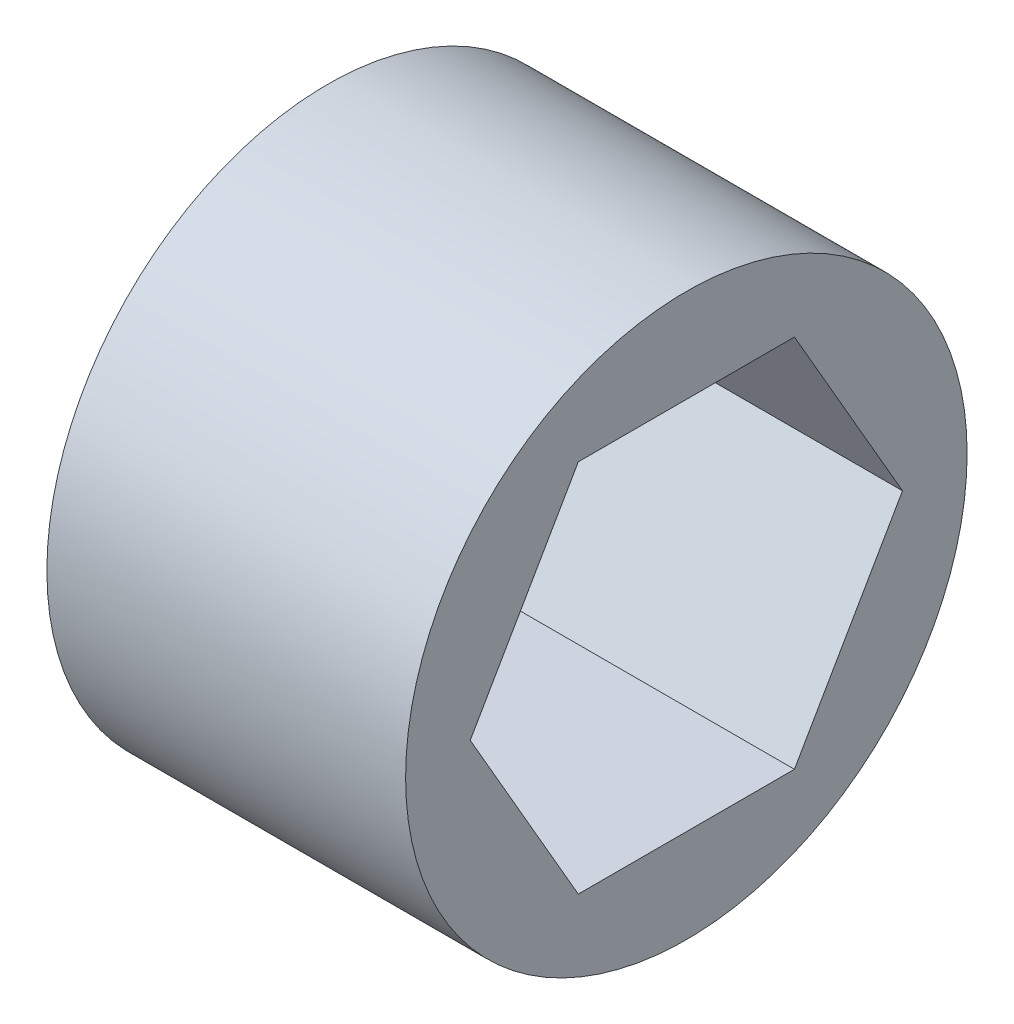
from build123d import *

# Parameters (mm, degrees)
SKETCH1_R           = 9.525
BOSS_EXTRUDE1_DEPTH = 6.085


with BuildPart() as part:
    # Sketch1 → Boss-Extrude1 (new, symmetric)
    with BuildSketch(Plane(origin=(0, 0, 0), x_dir=(0, 0, -1), z_dir=(1, 0, 0))):
        Circle(SKETCH1_R)
        Polygon((7.332348419, 0), (3.666174209, 6.35), (-3.666174209, 6.35), (-7.332348419, 0), (-3.666174209, -6.35), (3.666174209, -6.35), align=None, mode=Mode.SUBTRACT)
    extrude(amount=BOSS_EXTRUDE1_DEPTH, both=True)


solid = part.part
